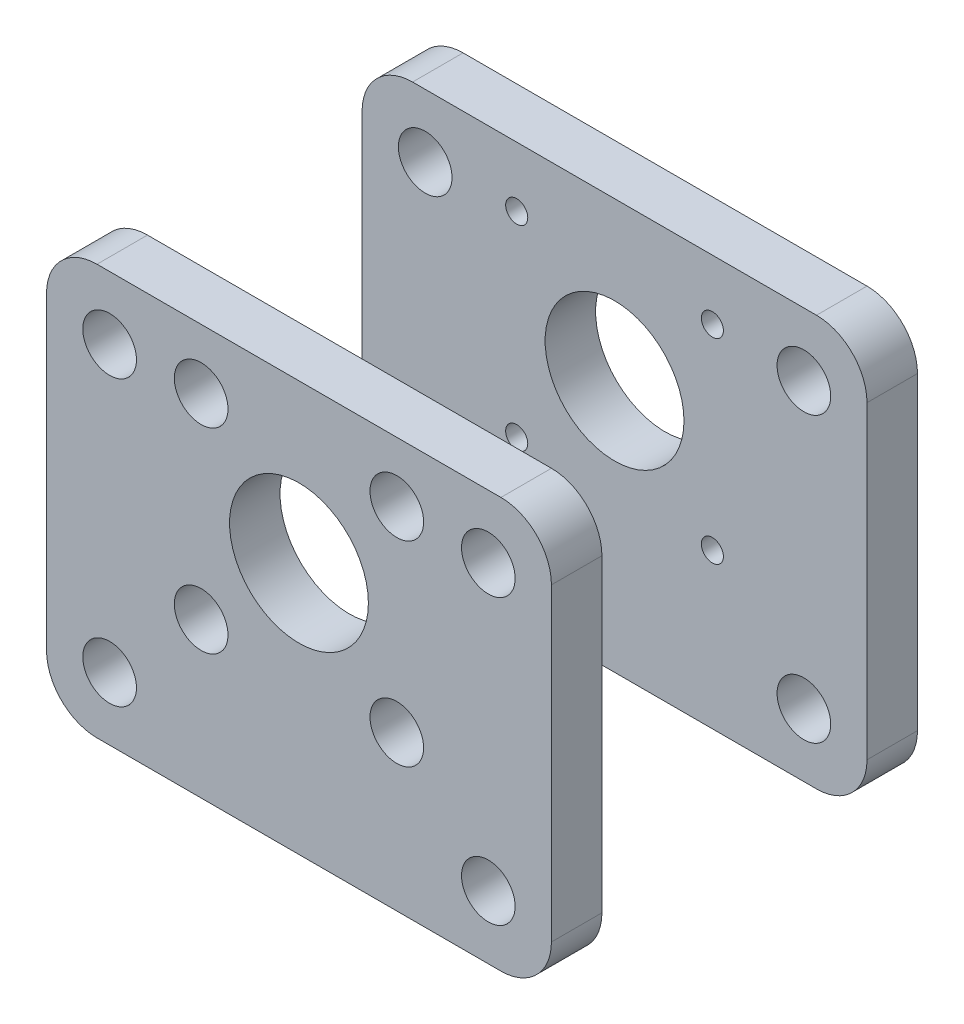
from build123d import *

# Parameters (mm, degrees)
SKIZZE1_W                       = 80
SKIZZE1_H                       = 65
SKIZZE1_R                       = 11
SKIZZE1_R_2                     = 1.75
SKIZZE1_R_3                     = 4.25
AUFSATZ_LINEAR_AUSTRAGEN1_DEPTH = 4
SKIZZE2_W                       = 80
SKIZZE2_H                       = 65
SKIZZE2_R                       = 11
SKIZZE2_R_2                     = 4.25
AUFSATZ_LINEAR_AUSTRAGEN2_DEPTH = 4
VERRUNDUNG1_R                   = 8
VERRUNDUNG2_R                   = 8


with BuildPart() as part:
    # Skizze1 → Aufsatz-Linear austragen1 (new, symmetric)
    with BuildSketch(Plane.XY):
        with Locations((0, -7.5)):
            Rectangle(SKIZZE1_W, SKIZZE1_H)
        Circle(SKIZZE1_R, mode=Mode.SUBTRACT)
        with Locations((-15.5, 15.5)):
            Circle(SKIZZE1_R_2, mode=Mode.SUBTRACT)
        with Locations((-15.5, -15.5)):
            Circle(SKIZZE1_R_2, mode=Mode.SUBTRACT)
        with Locations((15.5, 15.5)):
            Circle(SKIZZE1_R_2, mode=Mode.SUBTRACT)
        with Locations((15.5, -15.5)):
            Circle(SKIZZE1_R_2, mode=Mode.SUBTRACT)
        with Locations((-30, 15)):
            Circle(SKIZZE1_R_3, mode=Mode.SUBTRACT)
        with Locations((30, 15)):
            Circle(SKIZZE1_R_3, mode=Mode.SUBTRACT)
        with Locations((-30, -30)):
            Circle(SKIZZE1_R_3, mode=Mode.SUBTRACT)
        with Locations((30, -30)):
            Circle(SKIZZE1_R_3, mode=Mode.SUBTRACT)
    extrude(amount=AUFSATZ_LINEAR_AUSTRAGEN1_DEPTH, both=True)

    # Verrundung1
    verrundung1_edges = [part.edges().sort_by_distance(p)[0] for p in [
        (-40, 25, 0),
        (40, 25, 0),
        (40, -40, 0),
        (-40, -40, 0),
    ]]
    fillet(verrundung1_edges, radius=VERRUNDUNG1_R)


with BuildPart() as body_2:
    # Skizze2 → Aufsatz-Linear austragen2 (new, symmetric)
    with BuildSketch(Plane.XY.offset(50)):
        with Locations((0, -7.5)):
            Rectangle(SKIZZE2_W, SKIZZE2_H)
        Circle(SKIZZE2_R, mode=Mode.SUBTRACT)
        with Locations((-30, 15)):
            Circle(SKIZZE2_R_2, mode=Mode.SUBTRACT)
        with Locations((-30, -30)):
            Circle(SKIZZE2_R_2, mode=Mode.SUBTRACT)
        with Locations((30, -30)):
            Circle(SKIZZE2_R_2, mode=Mode.SUBTRACT)
        with Locations((30, 15)):
            Circle(SKIZZE2_R_2, mode=Mode.SUBTRACT)
        with Locations((-15.5, 15.5)):
            Circle(SKIZZE2_R_2, mode=Mode.SUBTRACT)
        with Locations((-15.5, -15.5)):
            Circle(SKIZZE2_R_2, mode=Mode.SUBTRACT)
        with Locations((15.5, -15.5)):
            Circle(SKIZZE2_R_2, mode=Mode.SUBTRACT)
        with Locations((15.5, 15.5)):
            Circle(SKIZZE2_R_2, mode=Mode.SUBTRACT)
    extrude(amount=AUFSATZ_LINEAR_AUSTRAGEN2_DEPTH, both=True)

    # Verrundung2
    verrundung2_edges = [body_2.edges().sort_by_distance(p)[0] for p in [
        (-40, 25, 50),
        (40, 25, 50),
        (40, -40, 50),
        (-40, -40, 50),
    ]]
    fillet(verrundung2_edges, radius=VERRUNDUNG2_R)


solid = Compound([part.part, body_2.part])
